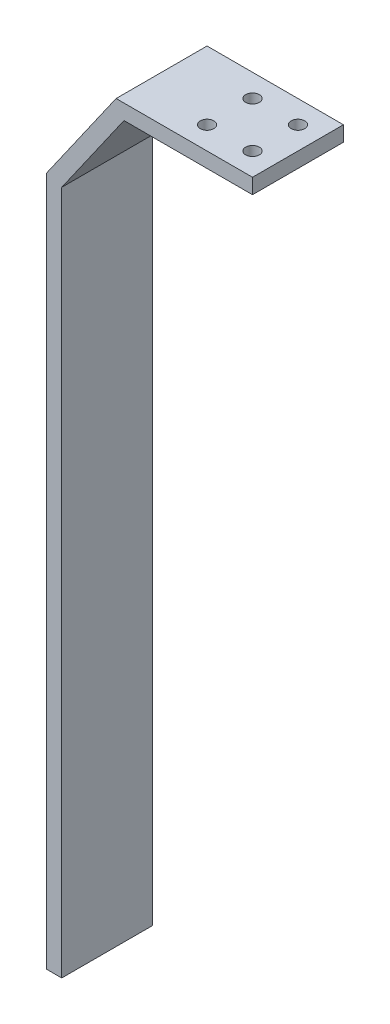
from build123d import *

# Parameters (mm, degrees)
BOSS_EXTRUDE1_DEPTH = 60
CUT_EXTRUDE1_REACH  = 543.312
SKETCH2_R           = 4.5


with BuildPart() as part:
    # Sketch1 → Boss-Extrude1 (new body)
    with BuildSketch(Plane.XY):
        Polygon((0, 0), (0, -445), (10, -445), (10, 0), (10, 6.847012111), (51.091785414, 65.532163543), (135.886114908, 65.532163543), (135.886114908, 75.532163543), (45.886114908, 75.532163543), (0, 10), align=None)
    extrude(amount=BOSS_EXTRUDE1_DEPTH)

    # Sketch2 → Cut-Extrude1 (cut, up to next)
    with BuildSketch(Plane(origin=(0, 75.532163543, 0), x_dir=(1, 0, 0), z_dir=(0, 1, 0)), mode=Mode.PRIVATE) as cut_extrude1_sk1:
        with Locations(Location((120.886114908, -15, 0), (0, 0, 180))):
            Circle(SKETCH2_R)
    cut_extrude1_tool1 = extrude(cut_extrude1_sk1.sketch, amount=-CUT_EXTRUDE1_REACH, mode=Mode.PRIVATE) & part.part
    # Sketch2 → Cut-Extrude1 (cut, up to next)
    with BuildSketch(Plane(origin=(0, 75.532163543, 0), x_dir=(1, 0, 0), z_dir=(0, 1, 0)), mode=Mode.PRIVATE) as cut_extrude1_sk2:
        with Locations(Location((120.886114908, -45, 0), (0, 0, 180))):
            Circle(SKETCH2_R)
    cut_extrude1_tool2 = extrude(cut_extrude1_sk2.sketch, amount=-CUT_EXTRUDE1_REACH, mode=Mode.PRIVATE) & part.part
    # Sketch2 → Cut-Extrude1 (cut, up to next)
    with BuildSketch(Plane(origin=(0, 75.532163543, 0), x_dir=(1, 0, 0), z_dir=(0, 1, 0)), mode=Mode.PRIVATE) as cut_extrude1_sk3:
        with Locations(Location((90.886114908, -15, 0), (0, 0, 180))):
            Circle(SKETCH2_R)
    cut_extrude1_tool3 = extrude(cut_extrude1_sk3.sketch, amount=-CUT_EXTRUDE1_REACH, mode=Mode.PRIVATE) & part.part
    # Sketch2 → Cut-Extrude1 (cut, up to next)
    with BuildSketch(Plane(origin=(0, 75.532163543, 0), x_dir=(1, 0, 0), z_dir=(0, 1, 0)), mode=Mode.PRIVATE) as cut_extrude1_sk4:
        with Locations(Location((90.886114908, -45, 0), (0, 0, 180))):
            Circle(SKETCH2_R)
    cut_extrude1_tool4 = extrude(cut_extrude1_sk4.sketch, amount=-CUT_EXTRUDE1_REACH, mode=Mode.PRIVATE) & part.part
    add(cut_extrude1_tool1.solids().sort_by_distance((120.886115, 75.532164, 15))[0], mode=Mode.SUBTRACT)
    add(cut_extrude1_tool2.solids().sort_by_distance((120.886115, 75.532164, 45))[0], mode=Mode.SUBTRACT)
    add(cut_extrude1_tool3.solids().sort_by_distance((90.886115, 75.532164, 15))[0], mode=Mode.SUBTRACT)
    add(cut_extrude1_tool4.solids().sort_by_distance((90.886115, 75.532164, 45))[0], mode=Mode.SUBTRACT)


solid = part.part
